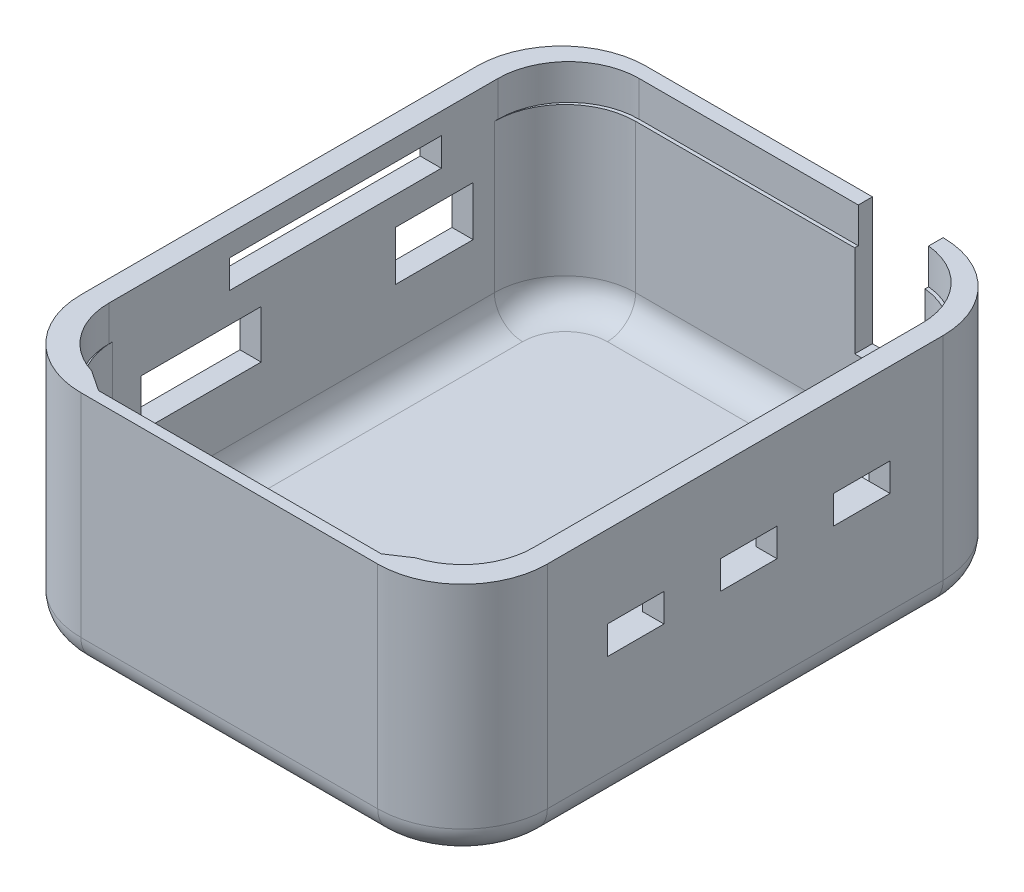
from build123d import *

# Parameters (mm, degrees)
EXTRUDE_1_DEPTH     = 9
EXTRUDE_2_DEPTH     = 1
SKETCH_4_W          = 8.5
SKETCH_4_H          = 3.4
SKETCH_4_W_2        = 15
SKETCH_4_H_2        = 2
SKETCH_4_W_3        = 5.5
SKETCH_4_H_3        = 3.5
CUT_EXTRUDE_1_DEPTH = 21
SKETCH_5_W          = 4
SKETCH_5_H          = 2
CUT_EXTRUDE_2_DEPTH = 7
EXTRUDE_3_DEPTH     = 6
SKETCH_9_W          = 5
SKETCH_9_H          = 1.5
CUT_EXTRUDE_4_DEPTH = 9
SKETCH_10_W         = 4.5
SKETCH_10_H         = 20
EXTRUDE_4_DEPTH     = 1.2
CUT_EXTRUDE_5_DEPTH = 2.5
CUT_EXTRUDE_6_DEPTH = 10
EXTRUDE_5_DEPTH     = 6
EXTRUDE_6_DEPTH     = 2
FILLET_1_R          = 2


with BuildPart() as part:
    # 草图1 → 凸台-拉伸1 (new body)
    with BuildSketch(Plane(origin=(0, 0, 0), x_dir=(1, 0, 0), z_dir=(0, 1, 0))):
        with BuildLine():
            Line((-16.5, 13.75), (-16.5, -14.25))
            ThreePointArc((-16.5, -14.25), (-14.742640687, -18.492640687), (-10.5, -20.25))
            Line((-10.5, -20.25), (10.5, -20.25))
            ThreePointArc((10.5, -20.25), (14.742640687, -18.492640687), (16.5, -14.25))
            Line((16.5, -14.25), (16.5, 13.75))
            ThreePointArc((16.5, 13.75), (14.742640687, 17.992640687), (10.5, 19.75))
            Line((10.5, 19.75), (-10.5, 19.75))
            ThreePointArc((-10.5, 19.75), (-14.742640687, 17.992640687), (-16.5, 13.75))
        make_face()
        with BuildLine():
            Line((-10, 18.5), (10, 18.5))
            ThreePointArc((10, 18.5), (13.535533906, 17.035533906), (15, 13.5))
            Line((15, 13.5), (15, -13.5))
            ThreePointArc((15, -13.5), (14.405736008, -15.864210276), (12.764203909, -17.666434537))
            Line((12.764203909, -17.666434537), (10, -19.500334285))
            Line((10, -19.500334285), (-10, -19.500334285))
            Line((-10, -19.500334285), (-12.764203909, -17.666434537))
            ThreePointArc((-12.764203909, -17.666434537), (-14.405736008, -15.864210276), (-15, -13.5))
            Line((-15, -13.5), (-15, 13.5))
            ThreePointArc((-15, 13.5), (-13.535533906, 17.035533906), (-10, 18.5))
        make_face(mode=Mode.SUBTRACT)
    extrude(amount=-EXTRUDE_1_DEPTH)

    # 草图3 → 凸台-拉伸2 (add)
    with BuildSketch(Plane.XZ.offset(9)):
        with BuildLine():
            Line((-10.5, -19.75), (10.5, -19.75))
            ThreePointArc((10.5, -19.75), (14.742640687, -17.992640687), (16.5, -13.75))
            Line((16.5, -13.75), (16.5, 14.25))
            ThreePointArc((16.5, 14.25), (14.742640687, 18.492640687), (10.5, 20.25))
            Line((10.5, 20.25), (-10.5, 20.25))
            ThreePointArc((-10.5, 20.25), (-14.742640687, 18.492640687), (-16.5, 14.25))
            Line((-16.5, 14.25), (-16.5, -13.75))
            ThreePointArc((-16.5, -13.75), (-14.742640687, -17.992640687), (-10.5, -19.75))
        make_face()
    extrude(amount=EXTRUDE_2_DEPTH)

    # 草图4 → 切除-拉伸1 (cut)
    with BuildSketch(Plane(origin=(-15, 0, 0), x_dir=(0, 0, -1), z_dir=(1, 0, 0))):
        with Locations((-7.250334285, -7.3)):
            Rectangle(SKETCH_4_W, SKETCH_4_H)
        with Locations((2.25, -2.5)):
            Rectangle(SKETCH_4_W_2, SKETCH_4_H_2)
        with Locations((9.25, -7.25)):
            Rectangle(SKETCH_4_W_3, SKETCH_4_H_3)
    extrude(amount=-CUT_EXTRUDE_1_DEPTH, mode=Mode.SUBTRACT)

    # 草图5 → 切除-拉伸2 (cut)
    with BuildSketch(Plane.ZY.offset(-15)):
        with Locations((0, -6.8)):
            Rectangle(SKETCH_5_W, SKETCH_5_H)
        with Locations((8, -6.8)):
            Rectangle(SKETCH_5_W, SKETCH_5_H)
        with Locations((-8, -6.8)):
            Rectangle(SKETCH_5_W, SKETCH_5_H)
    extrude(amount=-CUT_EXTRUDE_2_DEPTH, mode=Mode.SUBTRACT)

    # 草图6 → 凸台-拉伸3 (add)
    with BuildSketch(Plane(origin=(0, -9, 0), x_dir=(1, 0, 0), z_dir=(0, 1, 0))):
        Polygon((10, -19.500334285), (11.507785769, -18.5), (10, -18.5), (-10, -18.5), (-11.507785769, -18.5), (-10, -19.500334285), align=None)
    extrude(amount=EXTRUDE_3_DEPTH)

    # 草图9 → 切除-拉伸4 (cut)
    with BuildSketch(Plane(origin=(0, 0, 0), x_dir=(1, 0, 0), z_dir=(0, 1, 0))):
        with Locations((8, 19)):
            Rectangle(SKETCH_9_W, SKETCH_9_H)
    extrude(amount=-CUT_EXTRUDE_4_DEPTH, mode=Mode.SUBTRACT)

    # 草图10 → 凸台-拉伸4 (add)
    with BuildSketch(Plane(origin=(0, -9, 0), x_dir=(1, 0, 0), z_dir=(0, 1, 0))):
        with Locations((12.75, 0)):
            Rectangle(SKETCH_10_W, SKETCH_10_H)
    extrude(amount=EXTRUDE_4_DEPTH)

    # 草图12 → 切除-拉伸5 (cut)
    with BuildSketch(Plane(origin=(0, 0, 0), x_dir=(1, 0, 0), z_dir=(0, 1, 0))):
        with BuildLine():
            Line((10, -18.75), (-10, -18.75))
            ThreePointArc((-10, -18.75), (-13.535533906, -17.285533906), (-15, -13.75))
            Line((-15, -13.75), (-15, 13.75))
            ThreePointArc((-15, 13.75), (-13.535533906, 17.285533906), (-10, 18.75))
            Line((-10, 18.75), (10, 18.75))
            ThreePointArc((10, 18.75), (13.535533906, 17.285533906), (15, 13.75))
            Line((15, 13.75), (15, -13.75))
            ThreePointArc((15, -13.75), (13.535533906, -17.285533906), (10, -18.75))
        make_face()
    extrude(amount=-CUT_EXTRUDE_5_DEPTH, mode=Mode.SUBTRACT)

    # 草图13 → 切除-拉伸6 (cut)
    with BuildSketch(Plane(origin=(0, -9, 0), x_dir=(1, 0, 0), z_dir=(0, 1, 0))):
        with BuildLine():
            Line((-10, -18.5), (10, -18.5))
            ThreePointArc((10, -18.5), (13.535533906, -17.035533906), (15, -13.5))
            Line((15, -13.5), (15, 13.5))
            ThreePointArc((15, 13.5), (13.535533906, 17.035533906), (10, 18.5))
            Line((10, 18.5), (-10, 18.5))
            ThreePointArc((-10, 18.5), (-13.535533906, 17.035533906), (-15, 13.5))
            Line((-15, 13.5), (-15, -13.5))
            ThreePointArc((-15, -13.5), (-13.535533906, -17.035533906), (-10, -18.5))
        make_face()
    extrude(amount=-CUT_EXTRUDE_6_DEPTH, mode=Mode.SUBTRACT)

    # 草图14 → 凸台-拉伸5 (add)
    with BuildSketch(Plane.XZ.offset(9)):
        with BuildLine():
            Line((10.5, 20.25), (0, 20.25))
            Line((0, 20.25), (-10.5, 20.25))
            ThreePointArc((-10.5, 20.25), (-14.742640687, 18.492640687), (-16.5, 14.25))
            Line((-16.5, 14.25), (-16.5, -13.75))
            ThreePointArc((-16.5, -13.75), (-14.742640687, -17.992640687), (-10.5, -19.75))
            Line((-10.5, -19.75), (10.5, -19.75))
            ThreePointArc((10.5, -19.75), (14.742640687, -17.992640687), (16.5, -13.75))
            Line((16.5, -13.75), (16.5, 14.25))
            ThreePointArc((16.5, 14.25), (14.742640687, 18.492640687), (10.5, 20.25))
        make_face()
        with BuildLine():
            Line((-10, 18.5), (0, 18.5))
            Line((0, 18.5), (10, 18.5))
            ThreePointArc((10, 18.5), (13.535533906, 17.035533906), (15, 13.5))
            Line((15, 13.5), (15, 10))
            Line((15, 10), (15, -10))
            Line((15, -10), (15, -13.5))
            ThreePointArc((15, -13.5), (13.535533906, -17.035533906), (10, -18.5))
            Line((10, -18.5), (-10, -18.5))
            ThreePointArc((-10, -18.5), (-13.535533906, -17.035533906), (-15, -13.5))
            Line((-15, -13.5), (-15, 13.5))
            ThreePointArc((-15, 13.5), (-13.535533906, 17.035533906), (-10, 18.5))
        make_face(mode=Mode.SUBTRACT)
    extrude(amount=EXTRUDE_5_DEPTH)

    # 草图15 → 凸台-拉伸6 (add)
    with BuildSketch(Plane.XZ.offset(15)):
        with BuildLine():
            Line((-10.5, 20.25), (10.5, 20.25))
            ThreePointArc((10.5, 20.25), (14.742640687, 18.492640687), (16.5, 14.25))
            Line((16.5, 14.25), (16.5, -13.75))
            ThreePointArc((16.5, -13.75), (14.742640687, -17.992640687), (10.5, -19.75))
            Line((10.5, -19.75), (-10.5, -19.75))
            ThreePointArc((-10.5, -19.75), (-14.742640687, -17.992640687), (-16.5, -13.75))
            Line((-16.5, -13.75), (-16.5, 14.25))
            ThreePointArc((-16.5, 14.25), (-14.742640687, 18.492640687), (-10.5, 20.25))
        make_face()
    extrude(amount=EXTRUDE_6_DEPTH)

    # 圆角1
    fillet_1_edges = [part.edges().sort_by_distance(p)[0] for p in [
        (-13.535533906, -15, -17.035533906),
        (0, -15, -18.5),
        (13.535533906, -15, -17.035533906),
        (15, -15, 0),
        (13.535533906, -15, 17.035533906),
        (0, -15, 18.5),
        (-13.535533906, -15, 17.035533906),
        (-15, -15, 0),
        (-16.5, -17, 0.25),
        (-14.742640687, -17, 18.492640687),
        (0, -17, 20.25),
        (14.742640687, -17, 18.492640687),
        (16.5, -17, 0.25),
        (14.742640687, -17, -17.992640687),
        (0, -17, -19.75),
        (-14.742640687, -17, -17.992640687),
    ]]
    fillet(fillet_1_edges, radius=FILLET_1_R)


solid = part.part
